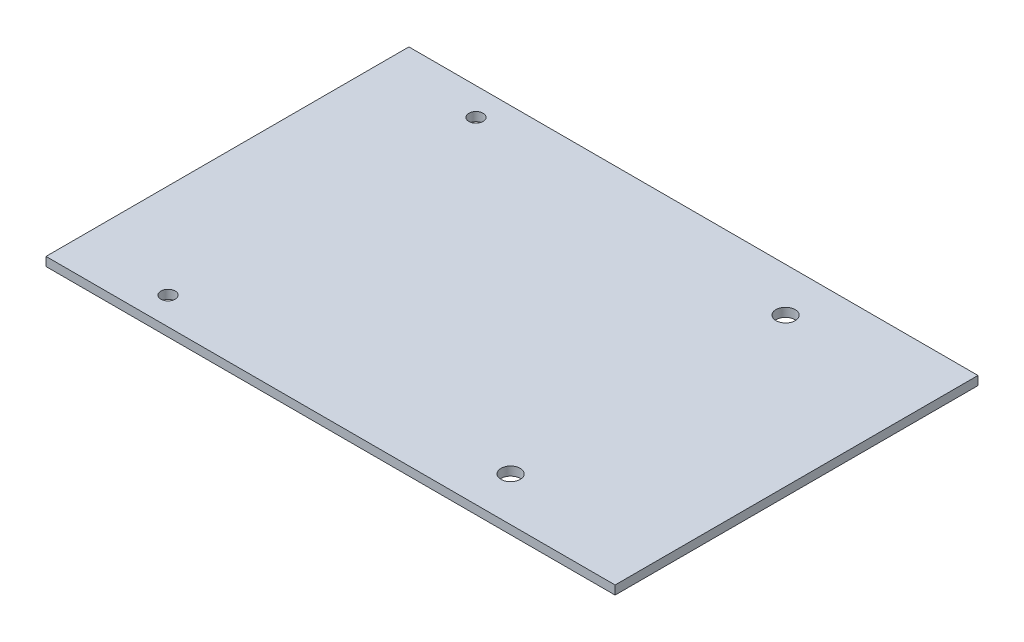
from build123d import *

# Parameters (mm, degrees)
SKETCH1_W           = 103.5
SKETCH1_H           = 66
BOSS_EXTRUDE1_DEPTH = 1.6
SKETCH3_R           = 1.3
CUT_EXTRUDE2_DEPTH  = 10
CUT_EXTRUDE3_REACH  = 63.397
SKETCH4_R           = 1.75


with BuildPart() as part:
    # Sketch1 → Boss-Extrude1 (new body)
    with BuildSketch(Plane(origin=(0, 0, 0), x_dir=(1, 0, 0), z_dir=(0, 1, 0))):
        Rectangle(SKETCH1_W, SKETCH1_H)
    extrude(amount=BOSS_EXTRUDE1_DEPTH)

    # Sketch3 → Cut-Extrude2 (cut)
    with BuildSketch(Plane(origin=(0, 1.6, 0), x_dir=(1, 0, 0), z_dir=(0, 1, 0))):
        with Locations(Location((-34.552335, 28, 0), (0, 0, 270))):
            Circle(SKETCH3_R)
        with Locations(Location((-34.552335, -28, 0), (0, 0, 270))):
            Circle(SKETCH3_R)
    extrude(amount=-CUT_EXTRUDE2_DEPTH, mode=Mode.SUBTRACT)

    # Sketch4 → Cut-Extrude3 (cut, up to next)
    with BuildSketch(Plane(origin=(0, 1.6, 0), x_dir=(1, 0, 0), z_dir=(0, 1, 0)), mode=Mode.PRIVATE) as cut_extrude3_sk1:
        with Locations(Location((24.75, 25, 0), (0, 0, 270))):
            Circle(SKETCH4_R)
    cut_extrude3_tool1 = extrude(cut_extrude3_sk1.sketch, amount=-CUT_EXTRUDE3_REACH, mode=Mode.PRIVATE) & part.part
    # Sketch4 → Cut-Extrude3 (cut, up to next)
    with BuildSketch(Plane(origin=(0, 1.6, 0), x_dir=(1, 0, 0), z_dir=(0, 1, 0)), mode=Mode.PRIVATE) as cut_extrude3_sk2:
        with Locations(Location((24.75, -25, 0), (0, 0, 270))):
            Circle(SKETCH4_R)
    cut_extrude3_tool2 = extrude(cut_extrude3_sk2.sketch, amount=-CUT_EXTRUDE3_REACH, mode=Mode.PRIVATE) & part.part
    add(cut_extrude3_tool1.solids().sort_by_distance((24.75, 1.6, -25))[0], mode=Mode.SUBTRACT)
    add(cut_extrude3_tool2.solids().sort_by_distance((24.75, 1.6, 25))[0], mode=Mode.SUBTRACT)


solid = part.part
